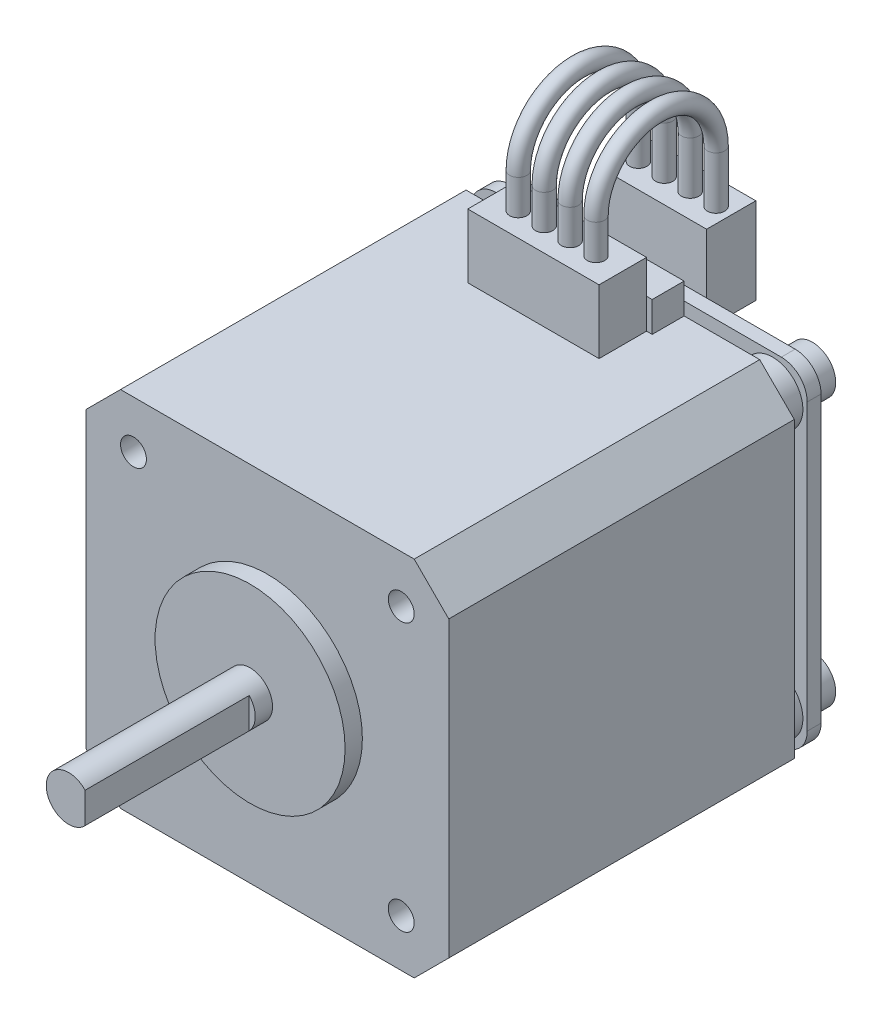
from build123d import *

# Parameters (mm, degrees)
SKETCH1_R            = 11
BOSS_EXTRUDE1_DEPTH  = 2
SKETCH2_R            = 2.6
BOSS_EXTRUDE2_DEPTH  = 21
CUT_EXTRUDE1_START   = -19
CUT_EXTRUDE1_DEPTH   = 19
SKETCH4_W            = 42
SKETCH4_H            = 42
BOSS_EXTRUDE3_DEPTH  = 40
CHAMFER1_SIZE        = 4
CUT_EXTRUDE2_DEPTH   = 70.649120597
SKETCH6_R            = 3.5
BOSS_EXTRUDE4_DEPTH  = 3
SKETCH7_W            = 39
SKETCH7_H            = 39
BOSS_EXTRUDE5_DEPTH  = 1.6
FILLET1_R            = 3
SKETCH8_W            = 16.5
SKETCH8_H            = 7
BOSS_EXTRUDE6_DEPTH  = 3.7
SKETCH9_W            = 15.2
SKETCH9_H            = 5.5
BOSS_EXTRUDE7_DEPTH  = 7.4
SKETCH10_W           = 12.5
SKETCH10_H           = 10
BOSS_EXTRUDE8_DEPTH  = 5.7
SKETCH11_R           = 1
SKETCH13_R           = 2.7
BOSS_EXTRUDE9_DEPTH  = 3
SKETCH14_W           = 12
SKETCH14_H           = 10
BOSS_EXTRUDE10_DEPTH = 2
SKETCH15_W           = 5
SKETCH15_H           = 3
BOSS_EXTRUDE11_DEPTH = 4
SKETCH16_W           = 7.2
SKETCH16_H           = 17.5
BOSS_EXTRUDE12_DEPTH = 5.7


with BuildPart() as part:
    # Sketch1 → Boss-Extrude1 (new body)
    with BuildSketch(Plane.XY):
        Circle(SKETCH1_R)
    extrude(amount=BOSS_EXTRUDE1_DEPTH)

    # Sketch2 → Boss-Extrude2 (add)
    with BuildSketch(Plane.XY.offset(2)):
        with Locations(Location((0, 0, 0), (0, 0, 180))):
            Circle(SKETCH2_R)
    extrude(amount=BOSS_EXTRUDE2_DEPTH)

    # Sketch3 → Cut-Extrude1 (cut)
    with BuildSketch(Plane.XY.offset(23).offset(CUT_EXTRUDE1_START)):
        with BuildLine():
            Line((1.9, 1.774823935), (1.9, -1.774823935))
            ThreePointArc((1.9, -1.774823935), (2.6, 0), (1.9, 1.774823935))
        make_face()
    extrude(amount=CUT_EXTRUDE1_DEPTH, mode=Mode.SUBTRACT)

    # Sketch4 → Boss-Extrude3 (add)
    with BuildSketch(Plane(origin=(0, 0, 0), x_dir=(-1, 0, 0), z_dir=(0, 0, -1))):
        Rectangle(SKETCH4_W, SKETCH4_H)
    extrude(amount=BOSS_EXTRUDE3_DEPTH)

    # Chamfer1
    chamfer1_edges = [part.edges().sort_by_distance(p)[0] for p in [
        (-21, -21, -20),
        (-21, 21, -20),
        (21, 21, -20),
        (21, -21, -20),
    ]]
    chamfer(chamfer1_edges, length=CHAMFER1_SIZE)

    # Sketch5 → Cut-Extrude2 (cut, through all)
    with BuildSketch(Plane(origin=(0, 0, -40), x_dir=(-1, 0, 0), z_dir=(0, 0, -1))):
        with BuildLine():
            ThreePointArc((-14, 15.5), (-16.560660172, 16.560660172), (-15.5, 14))
            Line((-15.5, 14), (-15.5, 15.5))
            Line((-15.5, 15.5), (-14, 15.5))
        make_face()
        with BuildLine():
            Line((-15.5, 15.5), (-15.5, 14))
            ThreePointArc((-15.5, 14), (-14.439339828, 14.439339828), (-14, 15.5))
            Line((-14, 15.5), (-15.5, 15.5))
        make_face()
        with BuildLine():
            ThreePointArc((14, 15.5), (14.439339828, 14.439339828), (15.5, 14))
            Line((15.5, 14), (15.5, 15.5))
            Line((15.5, 15.5), (14, 15.5))
        make_face()
        with BuildLine():
            Line((15.5, 15.5), (15.5, 14))
            ThreePointArc((15.5, 14), (16.560660172, 14.439339828), (17, 15.5))
            ThreePointArc((17, 15.5), (15.5, 17), (14, 15.5))
            Line((14, 15.5), (15.5, 15.5))
        make_face()
        with BuildLine():
            ThreePointArc((15.5, -14), (14.439339828, -14.439339828), (14, -15.5))
            Line((14, -15.5), (15.5, -15.5))
            Line((15.5, -15.5), (15.5, -14))
        make_face()
        with BuildLine():
            Line((15.5, -15.5), (14, -15.5))
            ThreePointArc((14, -15.5), (15.5, -17), (17, -15.5))
            ThreePointArc((17, -15.5), (16.560660172, -14.439339828), (15.5, -14))
            Line((15.5, -14), (15.5, -15.5))
        make_face()
        with BuildLine():
            Line((-15.5, -14), (-15.5, -15.5))
            Line((-15.5, -15.5), (-14, -15.5))
            ThreePointArc((-14, -15.5), (-14.439339828, -14.439339828), (-15.5, -14))
        make_face()
        with BuildLine():
            Line((-14, -15.5), (-15.5, -15.5))
            Line((-15.5, -15.5), (-15.5, -14))
            ThreePointArc((-15.5, -14), (-16.560660172, -16.560660172), (-14, -15.5))
        make_face()
    extrude(amount=-CUT_EXTRUDE2_DEPTH, mode=Mode.SUBTRACT)

    # Sketch6 → Boss-Extrude4 (add)
    with BuildSketch(Plane(origin=(0, 0, -40), x_dir=(-1, 0, 0), z_dir=(0, 0, -1))):
        with Locations(Location((-15.5, 15.5, 0), (0, 0, 180))):
            Circle(SKETCH6_R)
        with Locations(Location((15.5, 15.5, 0), (0, 0, 180))):
            Circle(SKETCH6_R)
        with Locations(Location((15.5, -15.5, 0), (0, 0, 180))):
            Circle(SKETCH6_R)
        with Locations(Location((-15.5, -15.5, 0), (0, 0, 180))):
            Circle(SKETCH6_R)
    extrude(amount=BOSS_EXTRUDE4_DEPTH)

    # Sketch7 → Boss-Extrude5 (add)
    with BuildSketch(Plane(origin=(0, 0, -43), x_dir=(-1, 0, 0), z_dir=(0, 0, -1))):
        Rectangle(SKETCH7_W, SKETCH7_H)
    extrude(amount=BOSS_EXTRUDE5_DEPTH)

    # Fillet1
    fillet1_edges = [part.edges().sort_by_distance(p)[0] for p in [
        (19.5, 19.5, -43.8),
        (19.5, -19.5, -43.8),
        (-19.5, -19.5, -43.8),
        (-19.5, 19.5, -43.8),
    ]]
    fillet(fillet1_edges, radius=FILLET1_R)

    # Sketch8 → Boss-Extrude6 (add)
    with BuildSketch(Plane(origin=(0, 0, -40), x_dir=(-1, 0, 0), z_dir=(0, 0, -1))):
        with Locations((0, 21)):
            Rectangle(SKETCH8_W, SKETCH8_H)
    extrude(amount=-BOSS_EXTRUDE6_DEPTH)

    # Sketch9 → Boss-Extrude7 (add)
    with BuildSketch(Plane(origin=(0, 21, 0), x_dir=(1, 0, 0), z_dir=(0, 1, 0))):
        with Locations((0, 33.55)):
            Rectangle(SKETCH9_W, SKETCH9_H)
    extrude(amount=BOSS_EXTRUDE7_DEPTH)

    # Sketch10 → Boss-Extrude8 (add)
    with BuildSketch(Plane(origin=(0, 0, -44.6), x_dir=(-1, 0, 0), z_dir=(0, 0, -1))):
        with Locations((0, 21.4)):
            Rectangle(SKETCH10_W, SKETCH10_H)
    extrude(amount=BOSS_EXTRUDE8_DEPTH)

    # Sweep1: sweep along a path in Sketch12
    with BuildLine(Plane(origin=(0, 0, 0), x_dir=(0, 0, -1), z_dir=(1, 0, 0))) as sweep1_path:
        Line((33.55, 28.4), (33.55, 32.45))
        ThreePointArc((33.55, 32.45), (40.5, 39.4), (47.45, 32.45))
        Line((47.45, 32.45), (47.45, 26.4))
    # Sketch11 → Sweep1 (sweep)
    with BuildSketch(Plane(origin=(0, 26.4, 0), x_dir=(1, 0, 0), z_dir=(0, 1, 0))):
        with Locations((-4.5, 47.45)):
            Circle(SKETCH11_R)
        with Locations((-1.5, 47.45)):
            Circle(SKETCH11_R)
        with Locations((1.5, 47.45)):
            Circle(SKETCH11_R)
        with Locations((4.5, 47.45)):
            Circle(SKETCH11_R)
    sweep(path=sweep1_path.line)

    # Sketch13 → Boss-Extrude9 (add)
    with BuildSketch(Plane(origin=(0, 0, -44.6), x_dir=(-1, 0, 0), z_dir=(0, 0, -1))):
        with Locations(Location((-15.5, 15.5, 0), (0, 0, 180))):
            Circle(SKETCH13_R)
        with Locations(Location((15.5, 15.5, 0), (0, 0, 180))):
            Circle(SKETCH13_R)
        with Locations(Location((-15.5, -15.5, 0), (0, 0, 180))):
            Circle(SKETCH13_R)
        with Locations(Location((15.5, -15.5, 0), (0, 0, 180))):
            Circle(SKETCH13_R)
    extrude(amount=BOSS_EXTRUDE9_DEPTH)

    # Sketch14 → Boss-Extrude10 (add)
    with BuildSketch(Plane(origin=(0, 0, -44.6), x_dir=(-1, 0, 0), z_dir=(0, 0, -1))):
        Rectangle(SKETCH14_W, SKETCH14_H)
    extrude(amount=BOSS_EXTRUDE10_DEPTH)

    # Sketch15 → Boss-Extrude11 (add)
    with BuildSketch(Plane(origin=(0, 0, -44.6), x_dir=(-1, 0, 0), z_dir=(0, 0, -1))):
        with Locations((-8, -17.5)):
            Rectangle(SKETCH15_W, SKETCH15_H)
        with Locations((0, -17.5)):
            Rectangle(SKETCH15_W, SKETCH15_H)
        with Locations((8, -17.5)):
            Rectangle(SKETCH15_W, SKETCH15_H)
    extrude(amount=BOSS_EXTRUDE11_DEPTH)

    # Sketch16 → Boss-Extrude12 (add)
    with BuildSketch(Plane(origin=(0, 0, -44.6), x_dir=(-1, 0, 0), z_dir=(0, 0, -1))):
        with Locations((20.4, 0)):
            Rectangle(SKETCH16_W, SKETCH16_H)
    extrude(amount=BOSS_EXTRUDE12_DEPTH)


solid = part.part
